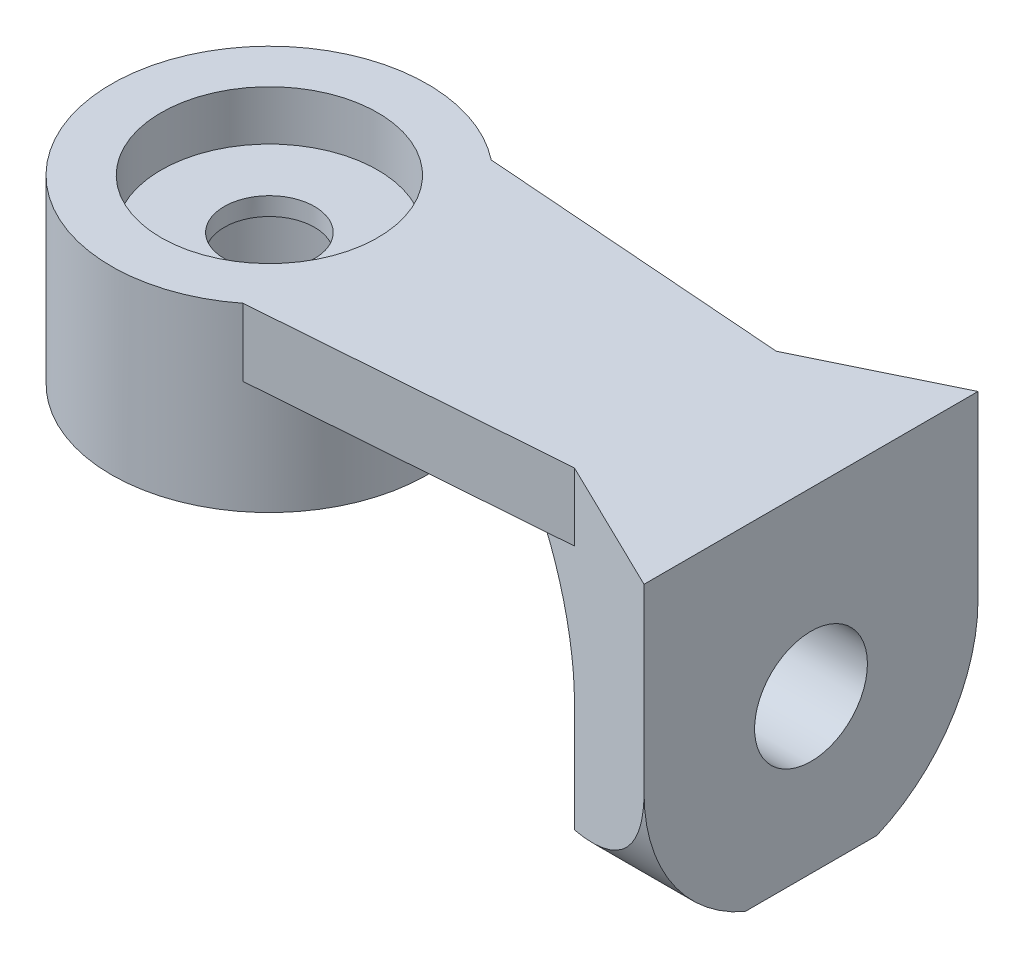
from build123d import *

# Parameters (mm, degrees)
SKETCH_1_R               = 3.5
EXTRUDE_1_DEPTH          = 4
SKETCH_2_R               = 2.4
CUT_EXTRUDE_1_DEPTH      = 1.1
SKETCH_3_R               = 1
CUT_EXTRUDE_2_DEPTH      = 6.736723804
SKETCH_4_R               = 2.3
CUT_EXTRUDE_3_DEPTH      = 2.5
EXTRUDE_START            = -1.5
EXTRUDE_2_DEPTH          = 1.5
EXTRUDE_3_DEPTH          = 7.4
CUT_EXTRUDE_4_DEPTH      = 17.902366698
CUT_EXTRUDE_4_DEPTH_BACK = 17.902366698
SKETCH_10_R              = 1.25
CUT_EXTRUDE_5_DEPTH      = 7.4


with BuildPart() as part:
    # Эскиз1 → Бобышка-Вытянуть1 (new body)
    with BuildSketch(Plane(origin=(0, 0, 0), x_dir=(1, 0, 0), z_dir=(0, 1, 0))):
        with Locations(Location((0, 0, 0), (0, 0, 270))):
            Circle(SKETCH_1_R)
    extrude(amount=EXTRUDE_1_DEPTH)

    # Эскиз2 → Вырез-Вытянуть1 (cut)
    with BuildSketch(Plane(origin=(0, 4, 0), x_dir=(1, 0, 0), z_dir=(0, 1, 0))):
        with Locations(Location((0, 0, 0), (0, 0, 270))):
            Circle(SKETCH_2_R)
    extrude(amount=-CUT_EXTRUDE_1_DEPTH, mode=Mode.SUBTRACT)

    # Эскиз3 → Вырез-Вытянуть2 (cut, through all)
    with BuildSketch(Plane(origin=(0, 2.9, 0), x_dir=(1, 0, 0), z_dir=(0, 1, 0))):
        with Locations(Location((0, 0, 0), (0, 0, 270))):
            Circle(SKETCH_3_R)
    extrude(amount=-CUT_EXTRUDE_2_DEPTH, mode=Mode.SUBTRACT)

    # Эскиз4 → Вырез-Вытянуть3 (cut)
    with BuildSketch(Plane(origin=(0, 0, 0), x_dir=(-1, 0, 0), z_dir=(0, -1, 0))):
        with Locations(Location((0, 0, 0), (0, 0, 90))):
            Circle(SKETCH_4_R)
    extrude(amount=-CUT_EXTRUDE_3_DEPTH, mode=Mode.SUBTRACT)

    # Эскиз5 → Бобышка-Вытянуть2 (add)
    with BuildSketch(Plane(origin=(0, 4, 0), x_dir=(1, 0, 0), z_dir=(0, 1, 0)).offset(EXTRUDE_START)):
        with BuildLine():
            Line((14.15, 1.85), (2.165063509, 2.75))
            ThreePointArc((2.165063509, 2.75), (3.5, 0), (2.165063509, -2.75))
            Line((2.165063509, -2.75), (14.15, -1.85))
            ThreePointArc((14.15, -1.85), (16, 0), (14.15, 1.85))
        make_face()
    extrude(amount=EXTRUDE_2_DEPTH)

    # Эскиз6 → Бобышка-Вытянуть3 (add)
    with BuildSketch(Plane(origin=(0, 4, 0), x_dir=(1, 0, 0), z_dir=(0, 1, 0))):
        Polygon((12, 0), (12, 3.7), (4.4, 0), (12, -3.7), align=None)
    extrude(amount=-EXTRUDE_3_DEPTH)

    # Эскиз9 → Вырез-Вытянуть4 (cut, two sides: drawn at the far end of the back side and taken through both)
    with BuildSketch(Plane.XY.offset(-CUT_EXTRUDE_4_DEPTH_BACK)):
        with BuildLine():
            ThreePointArc((5.997603859, 2.5), (8.11804802, 1.622196165), (8.997602836, -0.497522293))
            Line((8.997602836, -0.497522293), (9, -3.4))
            Line((9, -3.4), (2.724891775, -4.807995463))
            Line((2.724891775, -4.807995463), (4.4, 2.5))
            Line((4.4, 2.5), (5.997603859, 2.5))
        make_face()
        Polygon((17.66550591, -1.447270523), (12, 2.5), (12, 6.114360592), (17.66550591, 6.114360592), align=None)
    extrude(amount=CUT_EXTRUDE_4_DEPTH + CUT_EXTRUDE_4_DEPTH_BACK, mode=Mode.SUBTRACT)

    # Эскиз10 → Вырез-Вытянуть5 (cut)
    with BuildSketch(Plane(origin=(12, 0, 0), x_dir=(0, 0, -1), z_dir=(1, 0, 0))):
        Circle(SKETCH_10_R)
        with BuildLine():
            Line((-3.7, 0), (-6.427289466, -4.290908474))
            Line((-6.427289466, -4.290908474), (7.207363266, -4.845162651))
            Line((7.207363266, -4.845162651), (3.7, 0))
            ThreePointArc((3.7, 0), (0, -3.7), (-3.7, 0))
        make_face()
    extrude(amount=-CUT_EXTRUDE_5_DEPTH, mode=Mode.SUBTRACT)


solid = part.part
